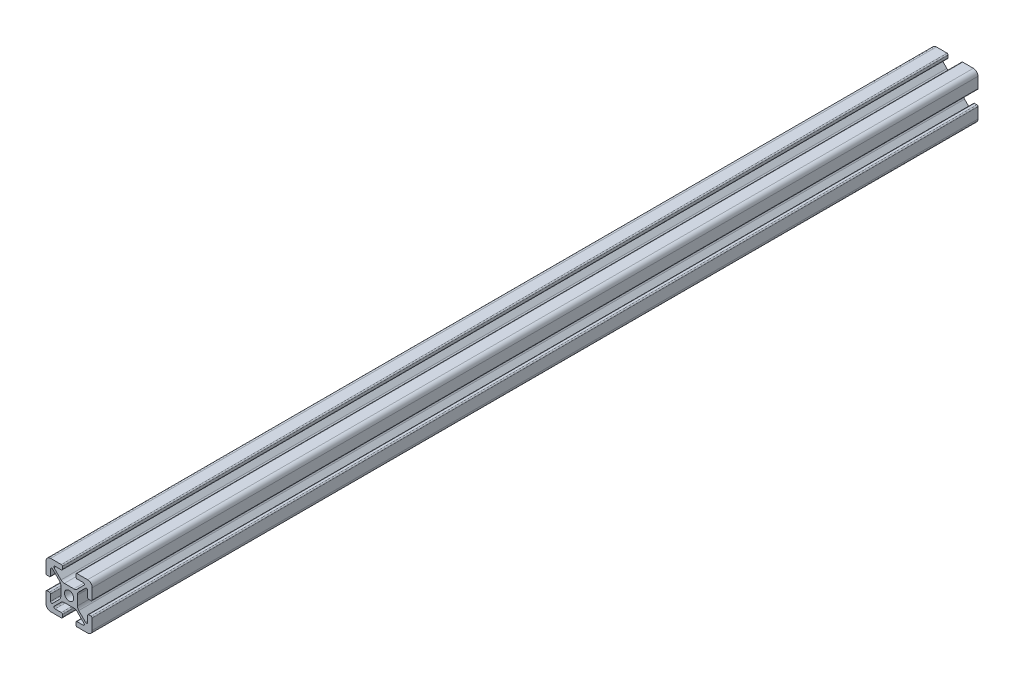
from build123d import *

# Parameters (mm, degrees)
SKETCH1_R           = 2.54
BOSS_EXTRUDE1_DEPTH = 486.918


with BuildPart() as part:
    # Sketch1 → Boss-Extrude1 (new body)
    with BuildSketch(Plane.XY):
        with BuildLine():
            Line((4.417923164, 5.315948776), (8.177961582, 9.075987194))
            ThreePointArc((8.177961582, 9.075987194), (8.315612279, 9.76800398), (7.728948776, 10.16))
            Line((7.728948776, 10.16), (4.308974388, 10.16))
            ThreePointArc((4.308974388, 10.16), (3.859961582, 10.345987194), (3.673974388, 10.795))
            Line((3.673974388, 10.795), (3.673974388, 12.065))
            ThreePointArc((3.673974388, 12.065), (3.859961582, 12.514012806), (4.308974388, 12.7))
            Line((4.308974388, 12.7), (10.16, 12.7))
            ThreePointArc((10.16, 12.7), (11.956051224, 11.956051224), (12.7, 10.16))
            Line((12.7, 10.16), (12.7, 4.308974388))
            ThreePointArc((12.7, 4.308974388), (12.514012806, 3.859961582), (12.065, 3.673974388))
            Line((12.065, 3.673974388), (10.795, 3.673974388))
            ThreePointArc((10.795, 3.673974388), (10.345987194, 3.859961582), (10.16, 4.308974388))
            Line((10.16, 4.308974388), (10.16, 7.728948776))
            ThreePointArc((10.16, 7.728948776), (9.76800398, 8.315612279), (9.075987194, 8.177961582))
            Line((9.075987194, 8.177961582), (5.315948776, 4.417923164))
            ThreePointArc((5.315948776, 4.417923164), (4.765345987, 3.593887858), (4.572, 2.621871939))
            Line((4.572, 2.621871939), (4.572, -2.621871939))
            ThreePointArc((4.572, -2.621871939), (4.765345987, -3.593887858), (5.315948776, -4.417923164))
            Line((5.315948776, -4.417923164), (9.075987194, -8.177961582))
            ThreePointArc((9.075987194, -8.177961582), (9.76800398, -8.315612279), (10.16, -7.728948776))
            Line((10.16, -7.728948776), (10.16, -4.308974388))
            ThreePointArc((10.16, -4.308974388), (10.345987194, -3.859961582), (10.795, -3.673974388))
            Line((10.795, -3.673974388), (12.065, -3.673974388))
            ThreePointArc((12.065, -3.673974388), (12.514012806, -3.859961582), (12.7, -4.308974388))
            Line((12.7, -4.308974388), (12.7, -10.16))
            ThreePointArc((12.7, -10.16), (11.956051224, -11.956051224), (10.16, -12.7))
            Line((10.16, -12.7), (4.308974388, -12.7))
            ThreePointArc((4.308974388, -12.7), (3.859961582, -12.514012806), (3.673974388, -12.065))
            Line((3.673974388, -12.065), (3.673974388, -10.795))
            ThreePointArc((3.673974388, -10.795), (3.859961582, -10.345987194), (4.308974388, -10.16))
            Line((4.308974388, -10.16), (7.728948776, -10.16))
            ThreePointArc((7.728948776, -10.16), (8.315612279, -9.76800398), (8.177961582, -9.075987194))
            Line((8.177961582, -9.075987194), (4.417923164, -5.315948776))
            ThreePointArc((4.417923164, -5.315948776), (3.593887858, -4.765345987), (2.621871939, -4.572))
            Line((2.621871939, -4.572), (-2.621871939, -4.572))
            ThreePointArc((-2.621871939, -4.572), (-3.593887858, -4.765345987), (-4.417923164, -5.315948776))
            Line((-4.417923164, -5.315948776), (-8.177961582, -9.075987194))
            ThreePointArc((-8.177961582, -9.075987194), (-8.315612279, -9.76800398), (-7.728948776, -10.16))
            Line((-7.728948776, -10.16), (-4.308974388, -10.16))
            ThreePointArc((-4.308974388, -10.16), (-3.859961582, -10.345987194), (-3.673974388, -10.795))
            Line((-3.673974388, -10.795), (-3.673974388, -12.065))
            ThreePointArc((-3.673974388, -12.065), (-3.859961582, -12.514012806), (-4.308974388, -12.7))
            Line((-4.308974388, -12.7), (-10.16, -12.7))
            ThreePointArc((-10.16, -12.7), (-11.956051224, -11.956051224), (-12.7, -10.16))
            Line((-12.7, -10.16), (-12.7, -4.308974388))
            ThreePointArc((-12.7, -4.308974388), (-12.514012806, -3.859961582), (-12.065, -3.673974388))
            Line((-12.065, -3.673974388), (-10.795, -3.673974388))
            ThreePointArc((-10.795, -3.673974388), (-10.345987194, -3.859961582), (-10.16, -4.308974388))
            Line((-10.16, -4.308974388), (-10.16, -7.728948776))
            ThreePointArc((-10.16, -7.728948776), (-9.76800398, -8.315612279), (-9.075987194, -8.177961582))
            Line((-9.075987194, -8.177961582), (-5.315948776, -4.417923164))
            ThreePointArc((-5.315948776, -4.417923164), (-4.765345987, -3.593887858), (-4.572, -2.621871939))
            Line((-4.572, -2.621871939), (-4.572, 2.621871939))
            ThreePointArc((-4.572, 2.621871939), (-4.765345987, 3.593887858), (-5.315948776, 4.417923164))
            Line((-5.315948776, 4.417923164), (-9.075987194, 8.177961582))
            ThreePointArc((-9.075987194, 8.177961582), (-9.76800398, 8.315612279), (-10.16, 7.728948776))
            Line((-10.16, 7.728948776), (-10.16, 4.308974388))
            ThreePointArc((-10.16, 4.308974388), (-10.345987194, 3.859961582), (-10.795, 3.673974388))
            Line((-10.795, 3.673974388), (-12.065, 3.673974388))
            ThreePointArc((-12.065, 3.673974388), (-12.514012806, 3.859961582), (-12.7, 4.308974388))
            Line((-12.7, 4.308974388), (-12.7, 10.16))
            ThreePointArc((-12.7, 10.16), (-11.956051224, 11.956051224), (-10.16, 12.7))
            Line((-10.16, 12.7), (-4.308974388, 12.7))
            ThreePointArc((-4.308974388, 12.7), (-3.859961582, 12.514012806), (-3.673974388, 12.065))
            Line((-3.673974388, 12.065), (-3.673974388, 10.795))
            ThreePointArc((-3.673974388, 10.795), (-3.859961582, 10.345987194), (-4.308974388, 10.16))
            Line((-4.308974388, 10.16), (-7.728948776, 10.16))
            ThreePointArc((-7.728948776, 10.16), (-8.315612279, 9.76800398), (-8.177961582, 9.075987194))
            Line((-8.177961582, 9.075987194), (-4.417923164, 5.315948776))
            ThreePointArc((-4.417923164, 5.315948776), (-3.593887858, 4.765345987), (-2.621871939, 4.572))
            Line((-2.621871939, 4.572), (2.621871939, 4.572))
            ThreePointArc((2.621871939, 4.572), (3.593887858, 4.765345987), (4.417923164, 5.315948776))
        make_face()
        Circle(SKETCH1_R, mode=Mode.SUBTRACT)
    extrude(amount=BOSS_EXTRUDE1_DEPTH)


solid = part.part
